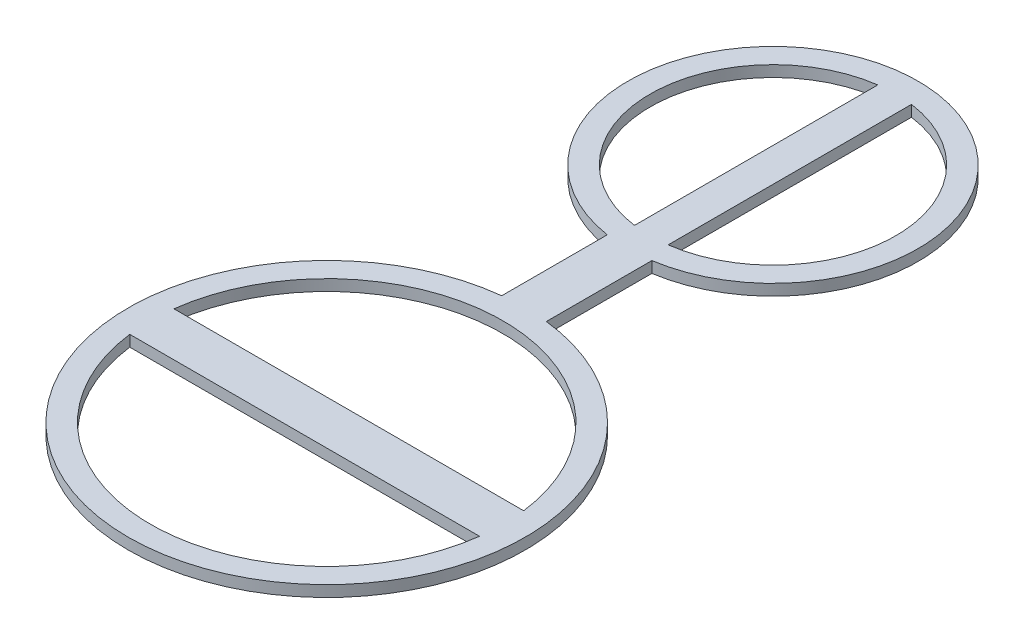
from build123d import *

# Parameters (mm, degrees)
BOSS_EXTRUDE1_DEPTH = 5


with BuildPart() as part:
    # Sketch1 → Boss-Extrude1 (new body)
    with BuildSketch(Plane(origin=(0, 0, 0), x_dir=(1, 0, 0), z_dir=(0, 1, 0))):
        with BuildLine():
            ThreePointArc((-10, 88.436417838), (0, -89), (10, 88.436417838))
            Line((10, 88.436417838), (10, 135.723235147))
            ThreePointArc((10, 135.723235147), (0, 265.05), (-10, 135.723235147))
            Line((-10, 135.723235147), (-10, 88.436417838))
        make_face()
        with BuildLine():
            ThreePointArc((-7.55, 145.470191638), (-55.05, 200), (-7.55, 254.529808362))
            Line((-7.55, 254.529808362), (-7.55, 145.470191638))
        make_face(mode=Mode.SUBTRACT)
        with BuildLine():
            Line((7.55, 145.470191638), (7.55, 254.529808362))
            ThreePointArc((7.55, 254.529808362), (55.05, 200), (7.55, 145.470191638))
        make_face(mode=Mode.SUBTRACT)
        with BuildLine():
            Line((-78.377228836, -9.9), (78.377228836, -9.9))
            ThreePointArc((78.377228836, -9.9), (0, -79), (-78.377228836, -9.9))
        make_face(mode=Mode.SUBTRACT)
        with BuildLine():
            Line((78.377228836, 9.9), (-78.377228836, 9.9))
            ThreePointArc((-78.377228836, 9.9), (0, 79), (78.377228836, 9.9))
        make_face(mode=Mode.SUBTRACT)
    extrude(amount=BOSS_EXTRUDE1_DEPTH)


solid = part.part
